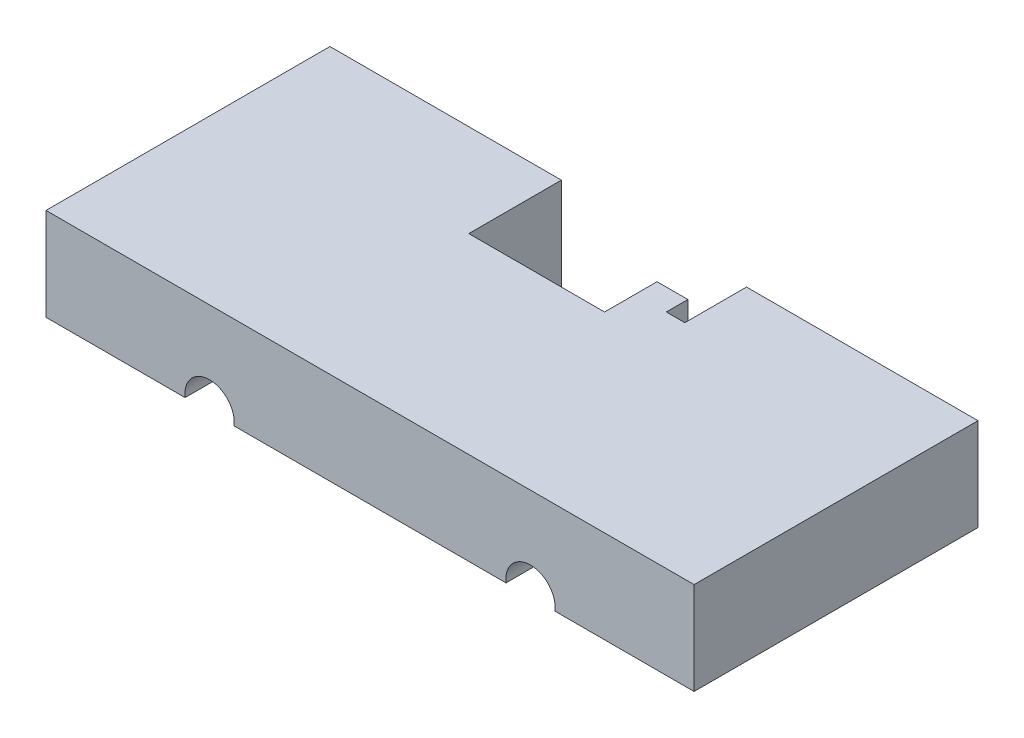
from build123d import *

# Parameters (mm, degrees)
SKETCH1_W               = 105
SKETCH1_H               = 92
BOSS_EXTRUDE1_DEPTH     = 15
SKETCH2_W               = 30
SKETCH2_H               = 30
CUT_EXTRUDE1_DEPTH      = 72
BOSS_EXTRUDE4_DEPTH     = 15
CUT_EXTRUDE2_DEPTH      = 84
CUT_EXTRUDE2_DEPTH_BACK = 64
SKETCH18_R              = 4
CUT_EXTRUDE3_DEPTH      = 10
CUT_EXTRUDE3_DEPTH_BACK = 10
SKETCH22_R              = 6
CUT_EXTRUDE4_DEPTH      = 10
CUT_EXTRUDE4_DEPTH_BACK = 10
SKETCH23_R              = 6
CUT_EXTRUDE5_DEPTH      = 10
CUT_EXTRUDE5_DEPTH_BACK = 10
SKETCH24_R              = 6
CUT_EXTRUDE7_DEPTH      = 2
CUT_EXTRUDE8_DEPTH      = 2
SKETCH30_W              = 105
SKETCH30_H              = 46
CUT_EXTRUDE11_DEPTH     = 40


with BuildPart() as part:
    # Sketch1 → Boss-Extrude1 (new body)
    with BuildSketch(Plane(origin=(0, 0, 0), x_dir=(1, 0, 0), z_dir=(0, 1, 0))):
        with Locations((52.5, 46)):
            Rectangle(SKETCH1_W, SKETCH1_H)
    extrude(amount=BOSS_EXTRUDE1_DEPTH)

    # Sketch2 → Cut-Extrude1 (cut)
    with BuildSketch(Plane(origin=(0, 15, 0), x_dir=(1, 0, 0), z_dir=(0, 1, 0))):
        with Locations((52.5, 46)):
            Rectangle(SKETCH2_W, SKETCH2_H)
    extrude(amount=-CUT_EXTRUDE1_DEPTH, mode=Mode.SUBTRACT)

    # Sketch15 → Boss-Extrude4 (add)
    with BuildSketch(Plane(origin=(0, 15, 0), x_dir=(1, 0, 0), z_dir=(0, 1, 0))):
        Polygon((72.5, 67), (72.5, 46), (72.5, 25), (59.5, 25), (59.5, 31), (59.5, 39.5), (64.5, 39.5), (64.5, 36), (67.5, 36), (67.5, 46), (67.5, 56), (64.5, 56), (64.5, 52.5), (59.5, 52.5), (59.5, 61), (59.5, 67), align=None)
    extrude(amount=-BOSS_EXTRUDE4_DEPTH)

    # Sketch18 → Cut-Extrude2 (cut, two sides: drawn at the far end of the back side and taken through both)
    with BuildSketch(Plane.XY.offset(-46).offset(-CUT_EXTRUDE2_DEPTH_BACK)):
        with Locations((26.5, 0.5)):
            Circle(SKETCH18_R)
        with Locations((78.5, 0.5)):
            Circle(SKETCH18_R)
    extrude(amount=CUT_EXTRUDE2_DEPTH + CUT_EXTRUDE2_DEPTH_BACK, mode=Mode.SUBTRACT)

    # Sketch22 → Cut-Extrude3 (cut, two sides: drawn at the far end of the back side and taken through both)
    with BuildSketch(Plane.XY.offset(-46).offset(-CUT_EXTRUDE3_DEPTH_BACK)):
        with Locations((26.5, 0.5)):
            Circle(SKETCH22_R)
    extrude(amount=CUT_EXTRUDE3_DEPTH + CUT_EXTRUDE3_DEPTH_BACK, mode=Mode.SUBTRACT)

    # Sketch23 → Cut-Extrude4 (cut, two sides: drawn at the far end of the back side and taken through both)
    with BuildSketch(Plane(origin=(0, 0, -69), x_dir=(-1, 0, 0), z_dir=(0, 0, -1)).offset(-CUT_EXTRUDE4_DEPTH_BACK)):
        with Locations((-78.5, 0.5)):
            Circle(SKETCH23_R)
    extrude(amount=CUT_EXTRUDE4_DEPTH + CUT_EXTRUDE4_DEPTH_BACK, mode=Mode.SUBTRACT)

    # Sketch24 → Cut-Extrude5 (cut, two sides: drawn at the far end of the back side and taken through both)
    with BuildSketch(Plane.XY.offset(-23).offset(-CUT_EXTRUDE5_DEPTH_BACK)):
        with Locations((78.5, 0.5)):
            Circle(SKETCH24_R)
    extrude(amount=CUT_EXTRUDE5_DEPTH + CUT_EXTRUDE5_DEPTH_BACK, mode=Mode.SUBTRACT)

    # Sketch27 → Cut-Extrude7 (cut)
    # profile 1 of 2: a face of its own
    with BuildSketch(Plane.ZY):
        with BuildLine():
            Line((-6.628929061, 4.581451926), (-6.943031625, 4.581451926))
            add(Edge.make_bspline(
                [(-6.943031625, 4.581451926), (-6.940984472, 4.623122814), (-6.936963918, 4.704963329), (-6.918135629, 4.824287235), (-6.891194752, 4.938342034), (-6.853103298, 5.046211948), (-6.80579702, 5.148850755), (-6.749066993, 5.245850771), (-6.681873142, 5.336841959), (-6.605666408, 5.420980803), (-6.522897769, 5.498168374), (-6.43359183, 5.564823616), (-6.339746802, 5.621141288), (-6.241647403, 5.66822253), (-6.13818684, 5.703562375), (-6.030303982, 5.729784015), (-5.917524846, 5.745560361), (-5.840684824, 5.747256146), (-5.801605343, 5.748118593)],
                knots=[0, 0, 0, 0, 1.10065271, 2.161652631, 3.183658789, 4.190468796, 5.17591951, 6.163126047, 7.15150782, 8.156236427, 9.156009102, 10.134482811, 11.092018607, 12.041330605, 13.001268258, 13.972401359, 14.968799086, 16, 16, 16, 16], degree=3))
            add(Edge.make_bspline(
                [(-5.801605343, 5.748118593), (-5.763227269, 5.747220137), (-5.687815725, 5.745454702), (-5.57775371, 5.730293673), (-5.472976416, 5.706548081), (-5.373688649, 5.673232665), (-5.280682585, 5.628448237), (-5.19325954, 5.574650699), (-5.110378729, 5.512430867), (-5.035771946, 5.439177054), (-4.967263866, 5.360974669), (-4.908161611, 5.277486766), (-4.857548448, 5.19125748), (-4.815360768, 5.101629278), (-4.784304629, 5.00775825), (-4.760726421, 4.911011047), (-4.747399007, 4.810386236), (-4.745353584, 4.74227968), (-4.744313677, 4.707653849)],
                knots=[0, 0, 0, 0, 1.111607364, 2.184268762, 3.212621178, 4.221274766, 5.211760367, 6.196651075, 7.1921475, 8.207485113, 9.220403448, 10.201281604, 11.166441695, 12.114753415, 13.065576456, 14.026450734, 14.996634279, 16, 16, 16, 16], degree=3))
            add(Edge.make_bspline(
                [(-4.744313677, 4.707653849), (-4.74600694, 4.658906015), (-4.749363751, 4.562265801), (-4.778078128, 4.420250938), (-4.822924639, 4.282657519), (-4.876921995, 4.171920217), (-4.93139444, 4.082686724), (-4.980481947, 4.009218019), (-5.037946758, 3.93011255), (-5.104625256, 3.845635213), (-5.179138128, 3.755124308), (-5.262160292, 3.658634512), (-5.354283774, 3.557162743), (-5.418942274, 3.487857141), (-5.45244669, 3.451944715)],
                knots=[0, 0, 0, 0, 1.184426356, 2.348067706, 3.509069118, 4.696110526, 5.333549288, 6.050745305, 6.844228056, 7.710549037, 8.667450064, 9.695053472, 10.805634456, 12, 12, 12, 12], degree=3))
            Line((-5.45244669, 3.451944715), (-6.328147811, 2.517349362))
            Line((-6.328147811, 2.517349362), (-4.699441882, 2.517349362))
            Line((-4.699441882, 2.517349362), (-4.699441882, 2.158375003))
            Line((-4.699441882, 2.158375003), (-7.07764701, 2.158375003))
            Line((-7.07764701, 2.158375003), (-5.720275215, 3.606892632))
            add(Edge.make_bspline(
                [(-5.720275215, 3.606892632), (-5.687227328, 3.641390938), (-5.623749101, 3.707655125), (-5.533966524, 3.804398085), (-5.453327536, 3.894147626), (-5.381310143, 3.976734174), (-5.319476638, 4.053365742), (-5.264604406, 4.121560445), (-5.220638815, 4.184314896), (-5.172923419, 4.25705551), (-5.126709438, 4.345867827), (-5.086997082, 4.454401516), (-5.062782234, 4.566128769), (-5.059877398, 4.641630806), (-5.058416241, 4.679608978)],
                knots=[0, 0, 0, 0, 1.329631726, 2.553950428, 3.673215718, 4.687767853, 5.603093632, 6.413772471, 7.123043292, 7.734684054, 8.834405432, 9.900288307, 10.943827018, 12, 12, 12, 12], degree=3))
            add(Edge.make_bspline(
                [(-5.058416241, 4.679608978), (-5.059051983, 4.703490376), (-5.060304909, 4.750556026), (-5.071362607, 4.819561785), (-5.088073113, 4.886126599), (-5.112018371, 4.950455218), (-5.143625111, 5.01190087), (-5.182098491, 5.070538351), (-5.226488554, 5.127227316), (-5.277839824, 5.180380614), (-5.334251343, 5.229061819), (-5.393845593, 5.272185905), (-5.456895697, 5.308225016), (-5.523135819, 5.337768513), (-5.592381289, 5.360943894), (-5.664766034, 5.377002473), (-5.74009005, 5.387084957), (-5.791523546, 5.388449129), (-5.817731145, 5.389144234)],
                knots=[0, 0, 0, 0, 0.991446411, 1.95395049, 2.89581595, 3.838931463, 4.798493298, 5.75982156, 6.748411868, 7.785213223, 8.824556874, 9.840280684, 10.836137867, 11.835679398, 12.848801643, 13.863922112, 14.911575587, 16, 16, 16, 16], degree=3))
            add(Edge.make_bspline(
                [(-5.817731145, 5.389144234), (-5.845101977, 5.388429202), (-5.898853774, 5.387024997), (-5.977772807, 5.377202333), (-6.053058584, 5.360256492), (-6.124900487, 5.337079818), (-6.193420073, 5.307621269), (-6.258284117, 5.270929524), (-6.319347006, 5.227146031), (-6.37672353, 5.177505475), (-6.429587509, 5.122237874), (-6.476034384, 5.06062791), (-6.516618399, 4.993800495), (-6.552027632, 4.921935945), (-6.580783322, 4.844382165), (-6.602756473, 4.76141446), (-6.620143319, 4.673393078), (-6.62595184, 4.612607993), (-6.628929061, 4.581451926)],
                knots=[0, 0, 0, 0, 1.031018746, 2.02475058, 2.990194455, 3.934040569, 4.864654155, 5.795059489, 6.735614925, 7.690564532, 8.649604399, 9.611025574, 10.590972636, 11.591080095, 12.624614302, 13.701020113, 14.821632451, 16, 16, 16, 16], degree=3))
        make_face()
    # profile 2 of 2: a face of its own
    with BuildSketch(Plane.ZY):
        with BuildLine():
            Line((-3.622518805, 2.068631414), (-3.873520408, 2.24321074))
            Line((-3.873520408, 2.24321074), (-2.900363356, 3.665786862))
            add(Edge.make_bspline(
                [(-2.900363356, 3.665786862), (-2.962454092, 3.658193799), (-3.084714212, 3.643242634), (-3.207851314, 3.640495979), (-3.268452299, 3.639144234)],
                knots=[0, 0, 0, 0, 1.015715272, 2, 2, 2, 2], degree=3))
            add(Edge.make_bspline(
                [(-3.268452299, 3.639144234), (-3.305194346, 3.640085311), (-3.377315773, 3.641932561), (-3.483347426, 3.65657437), (-3.585232986, 3.679124497), (-3.682702342, 3.712773252), (-3.776121847, 3.754591461), (-3.86528756, 3.806448475), (-3.950079451, 3.867454767), (-4.029586861, 3.937287758), (-4.1018986, 4.013965811), (-4.166321898, 4.095121454), (-4.21986303, 4.181697424), (-4.264339615, 4.271927644), (-4.298070068, 4.367108995), (-4.322632606, 4.466158395), (-4.33775496, 4.569770037), (-4.339554056, 4.640295168), (-4.340467523, 4.676103369)],
                knots=[0, 0, 0, 0, 1.060718605, 2.082097864, 3.085795603, 4.069760067, 5.054557537, 6.03741023, 7.043284206, 8.066802108, 9.088538119, 10.083643548, 11.053783639, 12.022749082, 12.983451788, 13.964007469, 14.966251758, 16, 16, 16, 16], degree=3))
            add(Edge.make_bspline(
                [(-4.340467523, 4.676103369), (-4.338733088, 4.725072021), (-4.335328744, 4.821187553), (-4.307930227, 4.961621322), (-4.262869888, 5.094407866), (-4.200041511, 5.21919806), (-4.12090679, 5.334196799), (-4.0257982, 5.437805408), (-3.915294235, 5.528550262), (-3.791912216, 5.606554339), (-3.658559195, 5.669289336), (-3.518890537, 5.715528637), (-3.373976417, 5.742727385), (-3.275808747, 5.746313246), (-3.226384991, 5.748118593)],
                knots=[0, 0, 0, 0, 1.022988612, 2.007919123, 2.978103895, 3.94594894, 4.918897164, 5.887013414, 6.875921846, 7.89917871, 8.930658928, 9.948724884, 10.967259574, 12, 12, 12, 12], degree=3))
            add(Edge.make_bspline(
                [(-3.226384991, 5.748118593), (-3.177896571, 5.74628843), (-3.082088024, 5.7426722), (-2.941199018, 5.716188231), (-2.806258001, 5.671551558), (-2.678013014, 5.609866995), (-2.559273602, 5.532546087), (-2.452497791, 5.440411563), (-2.360122252, 5.333406036), (-2.282298371, 5.214117546), (-2.219828331, 5.085950565), (-2.174756048, 4.952166642), (-2.147010409, 4.813727921), (-2.143514082, 4.719933447), (-2.141749574, 4.67259776)],
                knots=[0, 0, 0, 0, 1.026385292, 2.028040595, 3.023318987, 4.028184125, 5.03290303, 6.015178782, 7.004435299, 8.016004309, 9.023023918, 10.015172535, 10.998308025, 12, 12, 12, 12], degree=3))
            add(Edge.make_bspline(
                [(-2.141749574, 4.67259776), (-2.142927983, 4.635853993), (-2.145318091, 4.561328452), (-2.162054398, 4.448098109), (-2.190474583, 4.33264688), (-2.222726282, 4.234925284), (-2.25385845, 4.154216834), (-2.283159581, 4.090465254), (-2.315671735, 4.023363991), (-2.3535905, 3.953616653), (-2.394352797, 3.880334118), (-2.440412074, 3.804251402), (-2.490717645, 3.725266409), (-2.526547365, 3.672019321), (-2.544894606, 3.644753208)],
                knots=[0, 0, 0, 0, 1.179839688, 2.393009684, 3.667231171, 4.993948276, 5.694988576, 6.444077775, 7.246288328, 8.089075292, 8.993003841, 9.939041771, 10.944649915, 12, 12, 12, 12], degree=3))
            Line((-2.544894606, 3.644753208), (-3.622518805, 2.068631414))
        make_face()
        with BuildLine():
            add(Edge.make_bspline(
                [(-3.21025919, 3.998118593), (-3.182425175, 3.998878977), (-3.128241812, 4.000359186), (-3.048864513, 4.009368427), (-2.97394031, 4.025342414), (-2.903269061, 4.048262126), (-2.836142159, 4.075918794), (-2.773625831, 4.111130781), (-2.715667755, 4.153147415), (-2.661879828, 4.200357431), (-2.614115829, 4.252808015), (-2.571572798, 4.307705121), (-2.53541223, 4.365289731), (-2.506848953, 4.426282994), (-2.483364378, 4.489200202), (-2.467146366, 4.555054557), (-2.458162033, 4.623502958), (-2.456630458, 4.670001616), (-2.455852138, 4.693631414)],
                knots=[0, 0, 0, 0, 1.163407946, 2.26475976, 3.333800367, 4.359385343, 5.366239384, 6.363380779, 7.350133999, 8.353570782, 9.349036268, 10.310270964, 11.253520213, 12.184142, 13.120487599, 14.056272588, 15.012232024, 16, 16, 16, 16], degree=3))
            add(Edge.make_bspline(
                [(-2.455852138, 4.693631414), (-2.456521807, 4.717271079), (-2.457841473, 4.763855939), (-2.468428772, 4.832405679), (-2.487053996, 4.898098939), (-2.51204448, 4.961295369), (-2.544964718, 5.021475741), (-2.584468204, 5.079395613), (-2.631400654, 5.134687741), (-2.68540322, 5.186051724), (-2.743637773, 5.233399624), (-2.805698273, 5.2751857), (-2.871073189, 5.310206896), (-2.939363679, 5.339105866), (-3.010712028, 5.361657642), (-3.085076016, 5.377875006), (-3.162831422, 5.386846761), (-3.215612708, 5.388368655), (-3.242510792, 5.389144234)],
                knots=[0, 0, 0, 0, 0.972161553, 1.915763587, 2.844109794, 3.775983486, 4.705125789, 5.659731448, 6.655561913, 7.682237399, 8.721216875, 9.739758359, 10.754845918, 11.767244016, 12.7857855, 13.828538656, 14.893392813, 16, 16, 16, 16], degree=3))
            add(Edge.make_bspline(
                [(-3.242510792, 5.389144234), (-3.269174946, 5.388367402), (-3.321489795, 5.386843265), (-3.398553954, 5.37789206), (-3.472415122, 5.361548576), (-3.543556742, 5.339116312), (-3.611845203, 5.31020474), (-3.677217036, 5.275183865), (-3.739292052, 5.233409242), (-3.797470773, 5.18601447), (-3.851568695, 5.134926824), (-3.897694224, 5.079153395), (-3.937288116, 5.02150587), (-3.970163119, 4.961287362), (-3.995165636, 4.898101077), (-4.013787638, 4.8324051), (-4.024375803, 4.76385609), (-4.02569535, 4.71727113), (-4.026364959, 4.693631414)],
                knots=[0, 0, 0, 0, 1.099389452, 2.15699305, 3.192601482, 4.213358962, 5.227959689, 6.245255729, 7.266013209, 8.307253147, 9.336162325, 10.327954924, 11.284637477, 12.215801273, 13.149702402, 14.080068371, 15.025723358, 16, 16, 16, 16], degree=3))
            add(Edge.make_bspline(
                [(-4.026364959, 4.693631414), (-4.025759033, 4.669983215), (-4.024564036, 4.623344639), (-4.013036246, 4.554818246), (-3.993757966, 4.489130052), (-3.967938575, 4.425641345), (-3.933936985, 4.364969487), (-3.892213137, 4.307402125), (-3.843307591, 4.252286675), (-3.787874104, 4.200479463), (-3.727205943, 4.152927287), (-3.662409196, 4.111396905), (-3.59459936, 4.076324461), (-3.523537729, 4.048183077), (-3.449750929, 4.025571413), (-3.372575798, 4.009397868), (-3.29226756, 4.000445601), (-3.237857578, 3.998901704), (-3.21025919, 3.998118593)],
                knots=[0, 0, 0, 0, 0.952633368, 1.87876736, 2.791047057, 3.707742249, 4.635551637, 5.587206343, 6.568248508, 7.601284464, 8.641511608, 9.671105535, 10.699146789, 11.713763218, 12.747829548, 13.806491675, 14.887386225, 16, 16, 16, 16], degree=3))
        make_face(mode=Mode.SUBTRACT)
    extrude(amount=-CUT_EXTRUDE7_DEPTH, mode=Mode.SUBTRACT)

    # Sketch28 → Cut-Extrude8 (cut)
    # profile 1 of 2: a face of its own
    with BuildSketch(Plane(origin=(105, 0, 0), x_dir=(0, 0, -1), z_dir=(1, 0, 0))):
        with BuildLine():
            Line((85.444393694, 5.241356725), (85.13029113, 5.241356725))
            add(Edge.make_bspline(
                [(85.13029113, 5.241356725), (85.132338283, 5.283027613), (85.136358837, 5.364868127), (85.155187126, 5.484192034), (85.182128003, 5.598246832), (85.220219457, 5.706116746), (85.267525735, 5.808755554), (85.324255763, 5.905755569), (85.391449613, 5.996746758), (85.467656347, 6.080885601), (85.550424986, 6.158073172), (85.639730926, 6.224728415), (85.733575953, 6.281046086), (85.831675352, 6.328127328), (85.935135915, 6.363467174), (86.043018773, 6.389688814), (86.15579791, 6.405465159), (86.232637932, 6.407160945), (86.271717412, 6.408023392)],
                knots=[0, 0, 0, 0, 1.10065271, 2.161652631, 3.183658789, 4.190468796, 5.17591951, 6.163126047, 7.15150782, 8.156236427, 9.156009102, 10.134482811, 11.092018607, 12.041330605, 13.001268258, 13.972401359, 14.968799086, 16, 16, 16, 16], degree=3))
            add(Edge.make_bspline(
                [(86.271717412, 6.408023392), (86.310095486, 6.407124935), (86.385507031, 6.4053595), (86.495569045, 6.390198471), (86.60034634, 6.366452879), (86.699634106, 6.333137463), (86.792640171, 6.288353036), (86.880063215, 6.234555497), (86.962944026, 6.172335666), (87.03755081, 6.099081852), (87.106058889, 6.020879468), (87.165161144, 5.937391564), (87.215774308, 5.851162278), (87.257961987, 5.761534077), (87.289018126, 5.667663048), (87.312596334, 5.570915846), (87.325923748, 5.470291035), (87.327969172, 5.402184479), (87.329009079, 5.367558648)],
                knots=[0, 0, 0, 0, 1.111607364, 2.184268762, 3.212621178, 4.221274766, 5.211760367, 6.196651075, 7.1921475, 8.207485113, 9.220403448, 10.201281604, 11.166441695, 12.114753415, 13.065576456, 14.026450734, 14.996634279, 16, 16, 16, 16], degree=3))
            add(Edge.make_bspline(
                [(87.329009079, 5.367558648), (87.327315816, 5.318810813), (87.323959004, 5.2221706), (87.295244628, 5.080155737), (87.250398117, 4.942562318), (87.19640076, 4.831825016), (87.141928316, 4.742591522), (87.092840808, 4.669122817), (87.035375997, 4.590017349), (86.968697499, 4.505540011), (86.894184627, 4.415029106), (86.811162464, 4.318539311), (86.719038982, 4.217067541), (86.654380481, 4.14776194), (86.620876066, 4.111849513)],
                knots=[0, 0, 0, 0, 1.184426356, 2.348067706, 3.509069118, 4.696110526, 5.333549288, 6.050745305, 6.844228056, 7.710549037, 8.667450064, 9.695053472, 10.805634456, 12, 12, 12, 12], degree=3))
            Line((86.620876066, 4.111849513), (85.745174944, 3.177254161))
            Line((85.745174944, 3.177254161), (87.373880874, 3.177254161))
            Line((87.373880874, 3.177254161), (87.373880874, 2.818279802))
            Line((87.373880874, 2.818279802), (84.995675745, 2.818279802))
            Line((84.995675745, 2.818279802), (86.35304754, 4.26679743))
            add(Edge.make_bspline(
                [(86.35304754, 4.26679743), (86.386095427, 4.301295737), (86.449573654, 4.367559923), (86.539356231, 4.464302883), (86.619995219, 4.554052424), (86.692012612, 4.636638973), (86.753846117, 4.71327054), (86.808718349, 4.781465244), (86.85268394, 4.844219694), (86.900399336, 4.916960308), (86.946613317, 5.005772625), (86.986325673, 5.114306315), (87.010540522, 5.226033567), (87.013445357, 5.301535604), (87.014906515, 5.339513776)],
                knots=[0, 0, 0, 0, 1.329631726, 2.553950428, 3.673215718, 4.687767853, 5.603093632, 6.413772471, 7.123043292, 7.734684054, 8.834405432, 9.900288307, 10.943827018, 12, 12, 12, 12], degree=3))
            add(Edge.make_bspline(
                [(87.014906515, 5.339513776), (87.014270772, 5.363395175), (87.013017846, 5.410460825), (87.001960149, 5.479466584), (86.985249643, 5.546031398), (86.961304385, 5.610360017), (86.929697645, 5.671805669), (86.891224265, 5.730443149), (86.846834201, 5.787132114), (86.795482932, 5.840285412), (86.739071412, 5.888966618), (86.679477162, 5.932090703), (86.616427058, 5.968129814), (86.550186936, 5.997673311), (86.480941467, 6.020848693), (86.408556721, 6.036907272), (86.333232705, 6.046989756), (86.28179921, 6.048353928), (86.255591611, 6.049049033)],
                knots=[0, 0, 0, 0, 0.991446411, 1.95395049, 2.89581595, 3.838931463, 4.798493298, 5.75982156, 6.748411868, 7.785213223, 8.824556874, 9.840280684, 10.836137867, 11.835679398, 12.848801643, 13.863922112, 14.911575587, 16, 16, 16, 16], degree=3))
            add(Edge.make_bspline(
                [(86.255591611, 6.049049033), (86.228220778, 6.048334), (86.174468982, 6.046929795), (86.095549949, 6.037107131), (86.020264171, 6.020161291), (85.948422268, 5.996984616), (85.879902682, 5.967526067), (85.815038638, 5.930834323), (85.753975749, 5.88705083), (85.696599226, 5.837410273), (85.643735247, 5.782142672), (85.597288371, 5.720532709), (85.556704357, 5.653705294), (85.521295123, 5.581840743), (85.492539433, 5.504286963), (85.470566283, 5.421319258), (85.453179436, 5.333297877), (85.447370915, 5.272512792), (85.444393694, 5.241356725)],
                knots=[0, 0, 0, 0, 1.031018746, 2.02475058, 2.990194455, 3.934040569, 4.864654155, 5.795059489, 6.735614925, 7.690564532, 8.649604399, 9.611025574, 10.590972636, 11.591080095, 12.624614302, 13.701020113, 14.821632451, 16, 16, 16, 16], degree=3))
        make_face()
    # profile 2 of 2: a face of its own
    with BuildSketch(Plane(origin=(105, 0, 0), x_dir=(0, 0, -1), z_dir=(1, 0, 0))):
        with BuildLine():
            Line((88.45080395, 2.728536212), (88.199802348, 2.903115539))
            Line((88.199802348, 2.903115539), (89.172959399, 4.325691661))
            add(Edge.make_bspline(
                [(89.172959399, 4.325691661), (89.110868664, 4.318098598), (88.988608543, 4.303147433), (88.865471441, 4.300400778), (88.804870457, 4.299049033)],
                knots=[0, 0, 0, 0, 1.015715272, 2, 2, 2, 2], degree=3))
            add(Edge.make_bspline(
                [(88.804870457, 4.299049033), (88.768128409, 4.299990109), (88.696006982, 4.30183736), (88.58997533, 4.316479168), (88.488089769, 4.339029296), (88.390620413, 4.372678051), (88.297200908, 4.41449626), (88.208035195, 4.466353274), (88.123243304, 4.527359565), (88.043735894, 4.597192557), (87.971424156, 4.673870609), (87.907000858, 4.755026252), (87.853459726, 4.841602223), (87.80898314, 4.931832442), (87.775252687, 5.027013793), (87.750690149, 5.126063193), (87.735567795, 5.229674835), (87.733768699, 5.300199966), (87.732855232, 5.336008167)],
                knots=[0, 0, 0, 0, 1.060718605, 2.082097864, 3.085795603, 4.069760067, 5.054557537, 6.03741023, 7.043284206, 8.066802108, 9.088538119, 10.083643548, 11.053783639, 12.022749082, 12.983451788, 13.964007469, 14.966251758, 16, 16, 16, 16], degree=3))
            add(Edge.make_bspline(
                [(87.732855232, 5.336008167), (87.734589667, 5.38497682), (87.737994011, 5.481092352), (87.765392528, 5.621526121), (87.810452867, 5.754312664), (87.873281244, 5.879102858), (87.952415966, 5.994101597), (88.047524556, 6.097710206), (88.15802852, 6.18845506), (88.281410539, 6.266459138), (88.41476356, 6.329194135), (88.554432218, 6.375433435), (88.699346338, 6.402632183), (88.797514008, 6.406218044), (88.846937765, 6.408023392)],
                knots=[0, 0, 0, 0, 1.022988612, 2.007919123, 2.978103895, 3.94594894, 4.918897164, 5.887013414, 6.875921846, 7.89917871, 8.930658928, 9.948724884, 10.967259574, 12, 12, 12, 12], degree=3))
            add(Edge.make_bspline(
                [(88.846937765, 6.408023392), (88.895426184, 6.406193229), (88.991234731, 6.402576999), (89.132123738, 6.37609303), (89.267064754, 6.331456357), (89.395309741, 6.269771793), (89.514049153, 6.192450886), (89.620824965, 6.100316362), (89.713200504, 5.993310835), (89.791024384, 5.874022345), (89.853494425, 5.745855363), (89.898566708, 5.612071441), (89.926312347, 5.47363272), (89.929808674, 5.379838245), (89.931573181, 5.332502558)],
                knots=[0, 0, 0, 0, 1.026385292, 2.028040595, 3.023318987, 4.028184125, 5.03290303, 6.015178782, 7.004435299, 8.016004309, 9.023023918, 10.015172535, 10.998308025, 12, 12, 12, 12], degree=3))
            add(Edge.make_bspline(
                [(89.931573181, 5.332502558), (89.930394772, 5.295758791), (89.928004665, 5.22123325), (89.911268357, 5.108002908), (89.882848172, 4.992551678), (89.850596474, 4.894830082), (89.819464306, 4.814121633), (89.790163174, 4.750370053), (89.757651021, 4.683268789), (89.719732255, 4.613521451), (89.678969958, 4.540238916), (89.632910682, 4.464156201), (89.58260511, 4.385171208), (89.54677539, 4.331924119), (89.528428149, 4.304658007)],
                knots=[0, 0, 0, 0, 1.179839688, 2.393009684, 3.667231171, 4.993948276, 5.694988576, 6.444077775, 7.246288328, 8.089075292, 8.993003841, 9.939041771, 10.944649915, 12, 12, 12, 12], degree=3))
            Line((89.528428149, 4.304658007), (88.45080395, 2.728536212))
        make_face()
        with BuildLine():
            add(Edge.make_bspline(
                [(88.863063566, 4.658023392), (88.89089758, 4.658783775), (88.945080943, 4.660263984), (89.024458242, 4.669273226), (89.099382445, 4.685247212), (89.170053695, 4.708166924), (89.237180597, 4.735823593), (89.299696925, 4.771035579), (89.357655, 4.813052214), (89.411442927, 4.86026223), (89.459206927, 4.912712813), (89.501749958, 4.96760992), (89.537910525, 5.02519453), (89.566473802, 5.086187792), (89.589958378, 5.149105001), (89.60617639, 5.214959356), (89.615160723, 5.283407757), (89.616692298, 5.329906415), (89.617470617, 5.353536212)],
                knots=[0, 0, 0, 0, 1.163407946, 2.26475976, 3.333800367, 4.359385343, 5.366239384, 6.363380779, 7.350133999, 8.353570782, 9.349036268, 10.310270964, 11.253520213, 12.184142, 13.120487599, 14.056272588, 15.012232024, 16, 16, 16, 16], degree=3))
            add(Edge.make_bspline(
                [(89.617470617, 5.353536212), (89.616800948, 5.377175877), (89.615481283, 5.423760737), (89.604893983, 5.492310477), (89.58626876, 5.558003738), (89.561278275, 5.621200168), (89.528358037, 5.68138054), (89.488854552, 5.739300412), (89.441922102, 5.794592539), (89.387919536, 5.845956523), (89.329684983, 5.893304422), (89.267624482, 5.935090498), (89.202249566, 5.970111695), (89.133959077, 5.999010664), (89.062610728, 6.02156244), (88.988246739, 6.037779805), (88.910491334, 6.046751559), (88.857710048, 6.048273454), (88.830811963, 6.049049033)],
                knots=[0, 0, 0, 0, 0.972161553, 1.915763587, 2.844109794, 3.775983486, 4.705125789, 5.659731448, 6.655561913, 7.682237399, 8.721216875, 9.739758359, 10.754845918, 11.767244016, 12.7857855, 13.828538656, 14.893392813, 16, 16, 16, 16], degree=3))
            add(Edge.make_bspline(
                [(88.830811963, 6.049049033), (88.80414781, 6.048272201), (88.751832961, 6.046748064), (88.674768801, 6.037796858), (88.600907633, 6.021453374), (88.529766013, 5.99902111), (88.461477552, 5.970109539), (88.39610572, 5.935088663), (88.334030703, 5.893314041), (88.275851982, 5.845919268), (88.22175406, 5.794831622), (88.175628531, 5.739058193), (88.136034639, 5.681410669), (88.103159636, 5.621192161), (88.078157119, 5.558005875), (88.059535117, 5.492309898), (88.048946952, 5.423760888), (88.047627406, 5.377175928), (88.046957797, 5.353536212)],
                knots=[0, 0, 0, 0, 1.099389452, 2.15699305, 3.192601482, 4.213358962, 5.227959689, 6.245255729, 7.266013209, 8.307253147, 9.336162325, 10.327954924, 11.284637477, 12.215801273, 13.149702402, 14.080068371, 15.025723358, 16, 16, 16, 16], degree=3))
            add(Edge.make_bspline(
                [(88.046957797, 5.353536212), (88.047563723, 5.329888013), (88.04875872, 5.283249437), (88.06028651, 5.214723044), (88.079564789, 5.14903485), (88.10538418, 5.085546143), (88.13938577, 5.024874285), (88.181109618, 4.967306923), (88.230015164, 4.912191473), (88.285448652, 4.860384261), (88.346116813, 4.812832086), (88.410913559, 4.771301704), (88.478723396, 4.736229259), (88.549785027, 4.708087875), (88.623571826, 4.685476212), (88.700746958, 4.669302667), (88.781055195, 4.6603504), (88.835465177, 4.658806503), (88.863063566, 4.658023392)],
                knots=[0, 0, 0, 0, 0.952633368, 1.87876736, 2.791047057, 3.707742249, 4.635551637, 5.587206343, 6.568248508, 7.601284464, 8.641511608, 9.671105535, 10.699146789, 11.713763218, 12.747829548, 13.806491675, 14.887386225, 16, 16, 16, 16], degree=3))
        make_face(mode=Mode.SUBTRACT)
    extrude(amount=-CUT_EXTRUDE8_DEPTH, mode=Mode.SUBTRACT)

    # Sketch30 → Cut-Extrude11 (cut)
    with BuildSketch(Plane.XZ):
        with Locations((52.5, -69)):
            Rectangle(SKETCH30_W, SKETCH30_H)
    extrude(amount=-CUT_EXTRUDE11_DEPTH, mode=Mode.SUBTRACT)


solid = part.part
